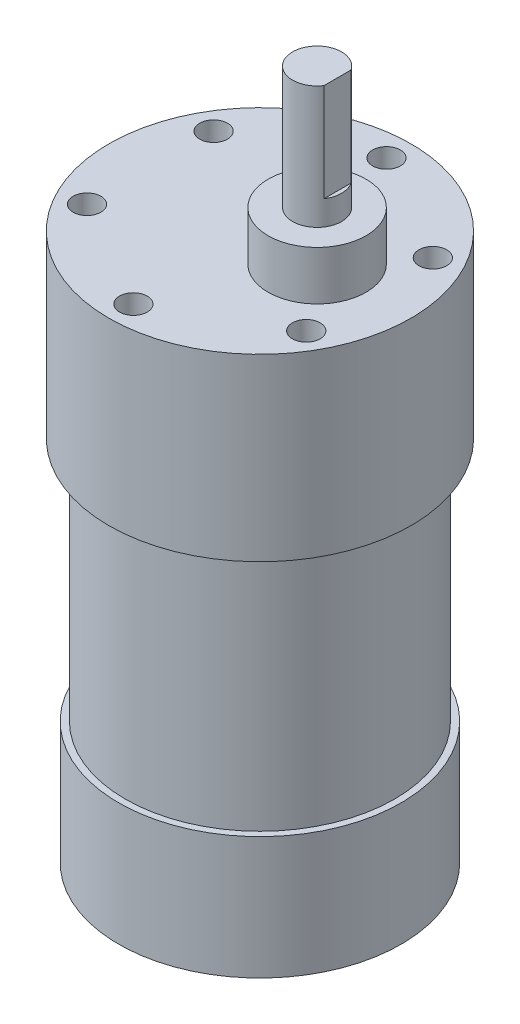
from build123d import *

# Parameters (mm, degrees)
SKETCH1_R                = 16.5
BOSS_EXTRUDE1_DEPTH      = 30
SKETCH2_R                = 2
BOSS_EXTRUDE2_DEPTH      = 2
SKETCH3_R                = 18.5
BOSS_EXTRUDE3_DEPTH      = 22
SKETCH5_R                = 6
BOSS_EXTRUDE4_DEPTH      = 6
SKETCH6_R                = 3
BOSS_EXTRUDE5_DEPTH      = 15
CUT_EXTRUDE1_START       = -12
CUT_EXTRUDE1_DEPTH       = 12
M3_CLEARANCE_HOLE1_D     = 3.4
M3_CLEARANCE_HOLE1_DEPTH = 10
M3_CLEARANCE_HOLE1_TIP   = 1.021463052
SKETCH16_R               = 17.3
BOSS_EXTRUDE6_DEPTH      = 15


with BuildPart() as part:
    # Sketch1 → Boss-Extrude1 (new body)
    with BuildSketch(Plane(origin=(0, 0, 0), x_dir=(1, 0, 0), z_dir=(0, 1, 0))):
        with Locations(Location((0, 0, 0), (0, 0, 270))):
            Circle(SKETCH1_R)
    extrude(amount=BOSS_EXTRUDE1_DEPTH)

    # Sketch2 → Boss-Extrude2 (add)
    with BuildSketch(Plane.XZ):
        with Locations(Location((0, 0, 0), (0, 0, 90))):
            Circle(SKETCH2_R)
    extrude(amount=BOSS_EXTRUDE2_DEPTH)

    # Sketch3 → Boss-Extrude3 (add)
    with BuildSketch(Plane(origin=(0, 30, 0), x_dir=(1, 0, 0), z_dir=(0, 1, 0))):
        with Locations(Location((0, 0, 0), (0, 0, 270))):
            Circle(SKETCH3_R)
    extrude(amount=BOSS_EXTRUDE3_DEPTH)

    # Sketch5 → Boss-Extrude4 (add)
    with BuildSketch(Plane(origin=(0, 52, 0), x_dir=(1, 0, 0), z_dir=(0, 1, 0))):
        with Locations(Location((7, 0, 0), (0, 0, 270))):
            Circle(SKETCH5_R)
    extrude(amount=BOSS_EXTRUDE4_DEPTH)

    # Sketch6 → Boss-Extrude5 (add)
    with BuildSketch(Plane(origin=(0, 58, 0), x_dir=(1, 0, 0), z_dir=(0, 1, 0))):
        with Locations(Location((7, 0, 0), (0, 0, 270))):
            Circle(SKETCH6_R)
    extrude(amount=BOSS_EXTRUDE5_DEPTH)

    # Sketch9 → Cut-Extrude1 (cut)
    with BuildSketch(Plane(origin=(0, 73, 0), x_dir=(1, 0, 0), z_dir=(0, 1, 0)).offset(CUT_EXTRUDE1_START)):
        with BuildLine():
            ThreePointArc((9.5, -1.658312395), (9.872281323, -0.866025404), (10, 0))
            Line((10, 0), (9.5, 0))
            Line((9.5, 0), (9.5, -1.658312395))
        make_face()
        with BuildLine():
            Line((9.5, 0), (10, 0))
            ThreePointArc((10, 0), (9.872281323, 0.866025404), (9.5, 1.658312395))
            Line((9.5, 1.658312395), (9.5, 0))
        make_face()
    extrude(amount=CUT_EXTRUDE1_DEPTH, mode=Mode.SUBTRACT)

    # M3 Clearance Hole1
    with Locations(Plane(origin=(0, 52, 0), x_dir=(1, 0, 0), z_dir=(0, 1, 0))):
        with Locations((0, -15.5), (-13.423393759, -7.75), (0, 15.5), (-13.423393759, 7.75), (13.423393759, -7.75), (13.423393759, 7.75)):
            Hole(M3_CLEARANCE_HOLE1_D / 2, depth=M3_CLEARANCE_HOLE1_DEPTH)
            with Locations((0, 0, -(M3_CLEARANCE_HOLE1_DEPTH + M3_CLEARANCE_HOLE1_TIP / 2))):  # 118° drill point
                Cone(0, M3_CLEARANCE_HOLE1_D / 2, M3_CLEARANCE_HOLE1_TIP, mode=Mode.SUBTRACT)

    # Sketch16 → Boss-Extrude6 (add)
    with BuildSketch(Plane.XZ):
        with Locations(Location((0, 0, 0), (0, 0, 270))):
            Circle(SKETCH16_R)
    extrude(amount=BOSS_EXTRUDE6_DEPTH)


solid = part.part
